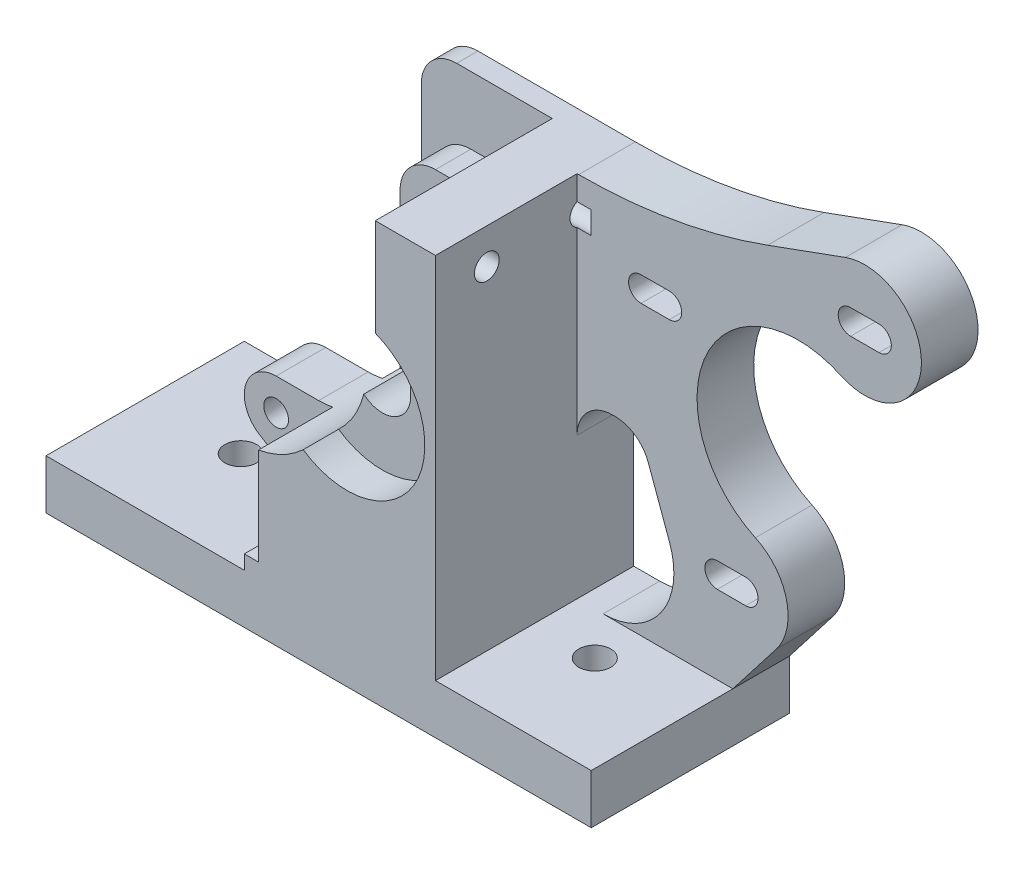
from build123d import *

# Parameters (mm, degrees)
SKETCH5_R                = 4
BOSS_EXTRUDE1_DEPTH      = 8
SKETCH6_R                = 4
BOSS_EXTRUDE2_DEPTH      = 20
SKETCH7_R                = 7.875
CUT_EXTRUDE1_DEPTH       = 4
SKETCH8_R                = 1.75
CUT_EXTRUDE2_DEPTH       = 64
SKETCH9_R                = 2.25
CUT_EXTRUDE3_DEPTH       = 64
FILLET1_R                = 10
FILLET2_R                = 78
FILLET3_R                = 5
SKETCH10_R               = 11
CUT_EXTRUDE4_DEPTH       = 5
CUT_EXTRUDE5_START       = -5
SKETCH11_R               = 11
CUT_EXTRUDE5_DEPTH       = 5
SKETCH13_R               = 1.75
CUT_EXTRUDE7_DEPTH       = 29
FILLET4_R                = 5
CUT_EXTRUDE8_DEPTH       = 29
CUT_EXTRUDE9_DEPTH       = 3
CUT_EXTRUDE10_START      = -20
SKETCH18_R               = 12.5
CUT_EXTRUDE10_DEPTH      = 20
BOSS_EXTRUDE3_DEPTH      = 3.5
BOSS_EXTRUDE3_DEPTH_BACK = 3.5
SKETCH19_R               = 1.75
CUT_EXTRUDE11_REACH      = 99.703
SKETCH20_W               = 18.5
SKETCH20_H               = 24
SKETCH21_W               = 18.5
SKETCH21_H               = 9.5
CUT_EXTRUDE12_DEPTH      = 5
SKETCH22_W               = 7.5
SKETCH22_H               = 40.5
SKETCH22_W_2             = 10.5
SKETCH22_H_2             = 30.300820781
CUT_EXTRUDE13_DEPTH      = 2
FILLET5_R                = 5
CUT_EXTRUDE14_DEPTH      = 2


with BuildPart() as part:
    # Sketch5 → Boss-Extrude1 (new body)
    with BuildSketch(Plane.XY):
        with BuildLine():
            Line((37.49753719, 0), (-39.50246281, 0))
            Line((-39.50246281, 0), (-39.50246281, 7))
            Line((-39.50246281, 7), (-11.5, 7))
            Line((-11.5, 7), (-11.5, 59))
            Line((-11.5, 59), (29.476702455, 59))
            Line((29.476702455, 59), (53.392166362, 67.704517001))
            ThreePointArc((53.392166362, 67.704517001), (64.120713281, 59.838020936), (52.747381415, 52.936513738))
            ThreePointArc((52.747381415, 52.936513738), (33.77847225, 46.032395426), (40.682590563, 27.063486262))
            ThreePointArc((40.682590563, 27.063486262), (44.048776035, 24.111420832), (45.301644469, 19.813023965))
            ThreePointArc((45.301644469, 19.813023965), (44.871359708, 17.224701884), (43.62679167, 14.91480869))
            Line((43.62679167, 14.91480869), (37.49753719, 7))
            Line((37.49753719, 7), (37.49753719, 0))
        make_face()
        with Locations((3, 35)):
            Circle(SKETCH5_R, mode=Mode.SUBTRACT)
        Polygon((15.5, 7), (15.5, 32), (24.352525767, 32), (33.451781623, 7), align=None, mode=Mode.SUBTRACT)
    extrude(amount=BOSS_EXTRUDE1_DEPTH)

    # Sketch6 → Boss-Extrude2 (add)
    with BuildSketch(Plane.XY.offset(8)):
        Polygon((37.49753719, 0), (-39.50246281, 0), (-39.50246281, 7), (-11.5, 7), (-11.5, 59), (15.5, 59), (15.5, 7), (37.49753719, 7), align=None)
        with Locations((3, 35)):
            Circle(SKETCH6_R, mode=Mode.SUBTRACT)
    extrude(amount=BOSS_EXTRUDE2_DEPTH)

    # Sketch7 → Cut-Extrude1 (cut)
    with BuildSketch(Plane.XZ):
        with Locations(Location((-1.00246281, 14, 0), (0, 0, 270))):
            Circle(SKETCH7_R)
    extrude(amount=-CUT_EXTRUDE1_DEPTH, mode=Mode.SUBTRACT)

    # Sketch8 → Cut-Extrude2 (cut)
    with BuildSketch(Plane(origin=(0, 59, 0), x_dir=(1, 0, 0), z_dir=(0, 1, 0))):
        with Locations(Location((-1.00246281, -14, 0), (0, 0, 180))):
            Circle(SKETCH8_R)
    extrude(amount=-CUT_EXTRUDE2_DEPTH, mode=Mode.SUBTRACT)

    # Sketch9 → Cut-Extrude3 (cut)
    with BuildSketch(Plane.XZ):
        with Locations(Location((23.99753719, 14, 0), (0, 0, 270))):
            Circle(SKETCH9_R)
        with Locations(Location((-26.00246281, 14, 0), (0, 0, 270))):
            Circle(SKETCH9_R)
    extrude(amount=-CUT_EXTRUDE3_DEPTH, mode=Mode.SUBTRACT)

    # Fillet1
    fillet1_edges = [part.edges().sort_by_distance(p)[0] for p in [
        (33.451781623, 7, 4),
    ]]
    fillet(fillet1_edges, radius=FILLET1_R)

    # Fillet2
    fillet2_edges = [part.edges().sort_by_distance(p)[0] for p in [
        (29.476702455, 59, 4),
    ]]
    fillet(fillet2_edges, radius=FILLET2_R)

    # Fillet3
    fillet3_edges = [part.edges().sort_by_distance(p)[0] for p in [
        (15.5, 32, 4),
    ]]
    fillet(fillet3_edges, radius=FILLET3_R)

    # Sketch10 → Cut-Extrude4 (cut)
    with BuildSketch(Plane(origin=(0, 0, 0), x_dir=(-1, 0, 0), z_dir=(0, 0, -1))):
        with Locations((-3, 35)):
            Circle(SKETCH10_R)
    extrude(amount=-CUT_EXTRUDE4_DEPTH, mode=Mode.SUBTRACT)

    # Sketch11 → Cut-Extrude5 (cut)
    with BuildSketch(Plane.XY.offset(28).offset(CUT_EXTRUDE5_START)):
        with Locations(Location((3, 35, 0), (0, 0, 180))):
            Circle(SKETCH11_R)
    extrude(amount=CUT_EXTRUDE5_DEPTH, mode=Mode.SUBTRACT)

    # Sketch13 → Cut-Extrude7 (cut)
    with BuildSketch(Plane.ZY.offset(11.5)):
        with Locations((20.75, 54)):
            Circle(SKETCH13_R)
        with Locations((7.25, 54)):
            Circle(SKETCH13_R)
    extrude(amount=-CUT_EXTRUDE7_DEPTH, mode=Mode.SUBTRACT)

    # Fillet4
    fillet4_edges = [part.edges().sort_by_distance(p)[0] for p in [
        (24.352525767, 32, 4),
    ]]
    fillet(fillet4_edges, radius=FILLET4_R)

    # Sketch14 → Cut-Extrude8 (cut)
    with BuildSketch(Plane.XY.offset(8)):
        with BuildLine():
            Line((58.128327509, 58.436976035), (54.128327509, 58.436976035))
            ThreePointArc((54.128327509, 58.436976035), (52.378327509, 60.186976035), (54.128327509, 61.936976035))
            Line((54.128327509, 61.936976035), (58.128327509, 61.936976035))
            ThreePointArc((58.128327509, 61.936976035), (59.878327509, 60.186976035), (58.128327509, 58.436976035))
        make_face()
        with BuildLine():
            Line((39.301644469, 18.063023965), (35.301644469, 18.063023965))
            ThreePointArc((35.301644469, 18.063023965), (33.551644469, 19.813023965), (35.301644469, 21.563023965))
            Line((35.301644469, 21.563023965), (39.301644469, 21.563023965))
            ThreePointArc((39.301644469, 21.563023965), (41.051644469, 19.813023965), (39.301644469, 18.063023965))
        make_face()
        with BuildLine():
            Line((28.528009954, 47.66334152), (24.528009954, 47.66334152))
            ThreePointArc((24.528009954, 47.66334152), (22.778009954, 49.41334152), (24.528009954, 51.16334152))
            Line((24.528009954, 51.16334152), (28.528009954, 51.16334152))
            ThreePointArc((28.528009954, 51.16334152), (30.278009954, 49.41334152), (28.528009954, 47.66334152))
        make_face()
    extrude(amount=-CUT_EXTRUDE8_DEPTH, mode=Mode.SUBTRACT)

    # Sketch15 → Cut-Extrude9 (cut)
    with BuildSketch(Plane(origin=(0, 0, 0), x_dir=(-1, 0, 0), z_dir=(0, 0, -1))):
        with BuildLine():
            Line((-39.301644469, 16.063023965), (-35.301644469, 16.063023965))
            ThreePointArc((-35.301644469, 16.063023965), (-31.551644469, 19.813023965), (-35.301644469, 23.563023965))
            Line((-35.301644469, 23.563023965), (-39.301644469, 23.563023965))
            ThreePointArc((-39.301644469, 23.563023965), (-43.051644469, 19.813023965), (-39.301644469, 16.063023965))
        make_face()
        with BuildLine():
            Line((-24.528009954, 53.16334152), (-28.528009954, 53.16334152))
            ThreePointArc((-28.528009954, 53.16334152), (-32.278009954, 49.41334152), (-28.528009954, 45.66334152))
            Line((-28.528009954, 45.66334152), (-24.528009954, 45.66334152))
            ThreePointArc((-24.528009954, 45.66334152), (-20.778009954, 49.41334152), (-24.528009954, 53.16334152))
        make_face()
        with BuildLine():
            Line((-54.128327509, 63.936976035), (-58.128327509, 63.936976035))
            ThreePointArc((-58.128327509, 63.936976035), (-61.878327509, 60.186976035), (-58.128327509, 56.436976035))
            Line((-58.128327509, 56.436976035), (-54.128327509, 56.436976035))
            ThreePointArc((-54.128327509, 56.436976035), (-50.378327509, 60.186976035), (-54.128327509, 63.936976035))
        make_face()
    extrude(amount=-CUT_EXTRUDE9_DEPTH, mode=Mode.SUBTRACT)

    # Sketch18 → Cut-Extrude10 (cut)
    with BuildSketch(Plane.XY.offset(28).offset(CUT_EXTRUDE10_START)):
        with Locations((-11.75246281, 35)):
            Circle(SKETCH18_R)
    extrude(amount=CUT_EXTRUDE10_DEPTH, mode=Mode.SUBTRACT)

    # Sketch19 → Boss-Extrude3 (add, two sides: drawn at the far end of the back side and taken through both)
    with BuildSketch(Plane.XY.offset(14).offset(-BOSS_EXTRUDE3_DEPTH_BACK)):
        with BuildLine():
            Line((-19.866362311, 14.172425126), (-11.5, 9))
            Line((-11.5, 9), (-11.5, 22.502549759))
            Line((-11.5, 22.502549759), (-17.501912014, 22.499999594))
            ThreePointArc((-17.501912014, 22.499999594), (-21.828891885, 19.229103353), (-19.866362311, 14.172425126))
        make_face()
        with Locations((-17.5, 18)):
            Circle(SKETCH19_R, mode=Mode.SUBTRACT)
    extrude(amount=BOSS_EXTRUDE3_DEPTH + BOSS_EXTRUDE3_DEPTH_BACK)

    # Cut-Extrude11: up to this face of the body (flat: up to its plane)
    cut_extrude11_end = Plane(part.part.faces().sort_by_distance((-6.507208391, 35, 8))[0])
    # Sketch20 → Cut-Extrude11 (cut, up to the picked face)
    with BuildSketch(Plane.XY.offset(28), mode=Mode.PRIVATE) as cut_extrude11_sk1:
        with Locations((-2.25, 47)):
            Rectangle(SKETCH20_W, SKETCH20_H)
    cut_extrude11_tool1 = split(extrude(cut_extrude11_sk1.sketch, amount=-CUT_EXTRUDE11_REACH, mode=Mode.PRIVATE), bisect_by=cut_extrude11_end, keep=Keep.BOTH, mode=Mode.PRIVATE)
    add(cut_extrude11_tool1.solids().sort_by(Axis((-2.25, 47, 28), (0, 0, -1)))[0], mode=Mode.SUBTRACT)

    # Sketch21 → Cut-Extrude12 (cut)
    with BuildSketch(Plane.XY.offset(8)):
        with Locations((-2.25, 54.25)):
            Rectangle(SKETCH21_W, SKETCH21_H)
    extrude(amount=-CUT_EXTRUDE12_DEPTH, mode=Mode.SUBTRACT)

    # Sketch22 → Cut-Extrude13 (cut)
    with BuildSketch(Plane.ZY.offset(11.5)):
        with Locations((6.75, 29.25)):
            Rectangle(SKETCH22_W, SKETCH22_H)
        with Locations((22.75, 24.150410391)):
            Rectangle(SKETCH22_W_2, SKETCH22_H_2)
    extrude(amount=-CUT_EXTRUDE13_DEPTH, mode=Mode.SUBTRACT)

    # Fillet5
    fillet5_edges = [part.edges().sort_by_distance(p)[0] for p in [
        (-11.5, 59, 1.5),
        (-9.5, 49.5, 5.5),
    ]]
    fillet(fillet5_edges, radius=FILLET5_R)

    # Sketch23 → Cut-Extrude14 (cut)
    with BuildSketch(Plane.XY.offset(8)):
        with BuildLine():
            Line((-9.5, 40), (-8.5, 40))
            ThreePointArc((-8.5, 40), (-3.5, 35), (-8.5, 30))
            Line((-8.5, 30), (-9.5, 30))
            ThreePointArc((-9.5, 30), (-14.5, 35), (-9.5, 40))
        make_face()
    extrude(amount=-CUT_EXTRUDE14_DEPTH, mode=Mode.SUBTRACT)


solid = part.part
